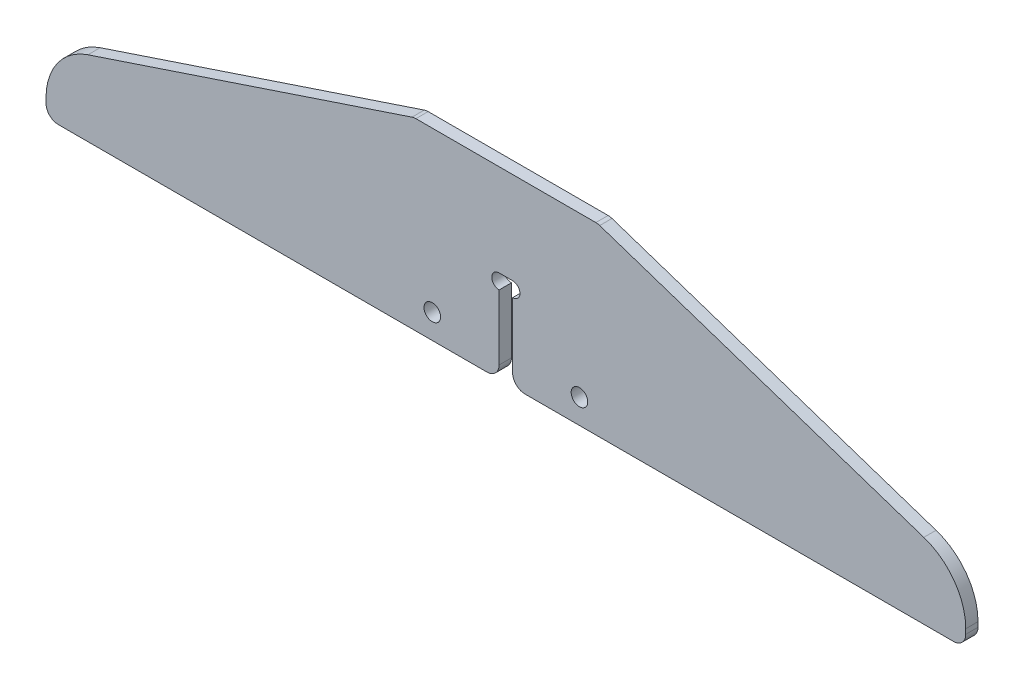
from build123d import *

# Parameters (mm, degrees)
EXTRUDE_1_DEPTH     = 1
CUT_EXTRUDE_1_DEPTH = 81.802227692
SKETCH_4_R          = 1.35
CUT_EXTRUDE_3_DEPTH = 81.802227692
FILLET_1_R          = 10
FILLET_2_R          = 2


with BuildPart() as part:
    # 草图1 → 凸台-拉伸1 (new, symmetric)
    with BuildSketch(Plane.XY):
        Polygon((15, 30), (-15, 30), (-75, 10), (-75, 0), (75, 0), (75, 10), align=None)
    extrude(amount=EXTRUDE_1_DEPTH, both=True)

    # 草图2 → 切除-拉伸1 (cut, through all)
    with BuildSketch(Plane.XY.offset(1)):
        with BuildLine():
            Line((1.1, 15), (-1.1, 15))
            ThreePointArc((-1.1, 15), (-2.3, 13.8), (-1.1, 12.6))
            Line((-1.1, 12.6), (-1.1, 0))
            Line((-1.1, 0), (1.1, 0))
            Line((1.1, 0), (1.1, 12.6))
            ThreePointArc((1.1, 12.6), (2.3, 13.8), (1.1, 15))
        make_face()
    extrude(amount=-CUT_EXTRUDE_1_DEPTH, mode=Mode.SUBTRACT)

    # 草图4 → 切除-拉伸3 (cut, through all)
    with BuildSketch(Plane.XY.offset(1)):
        with Locations((-12, 4)):
            Circle(SKETCH_4_R)
        with Locations((12, 4)):
            Circle(SKETCH_4_R)
    extrude(amount=-CUT_EXTRUDE_3_DEPTH, mode=Mode.SUBTRACT)

    # 圆角1
    fillet_1_edges = [part.edges().sort_by_distance(p)[0] for p in [
        (-75, 10, 0),
        (75, 10, 0),
    ]]
    fillet(fillet_1_edges, radius=FILLET_1_R)

    # 圆角2
    fillet_2_edges = [part.edges().sort_by_distance(p)[0] for p in [
        (15, 30, 0),
        (-15, 30, 0),
        (75, 0, 0),
        (-75, 0, 0),
        (1.1, 0, 0),
        (-1.1, 0, 0),
    ]]
    fillet(fillet_2_edges, radius=FILLET_2_R)


solid = part.part
